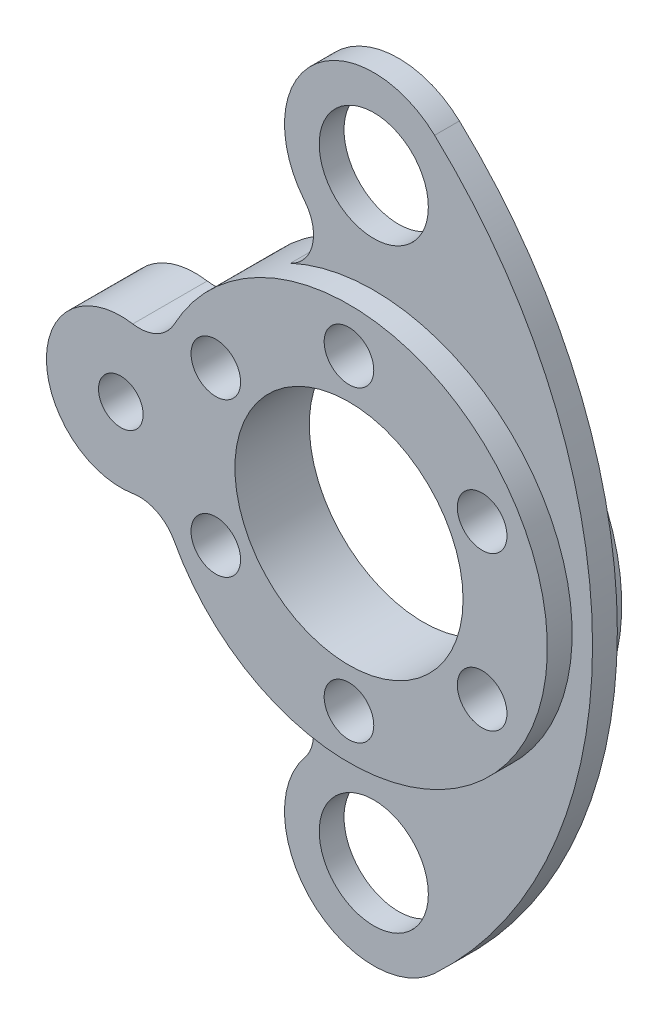
from build123d import *

# Parameters (mm, degrees)
BOSS_EXTRUDE2_DEPTH = 15
SKETCH2_R           = 18
SKETCH2_R_2         = 11
BOSS_EXTRUDE3_DEPTH = 2.5


with BuildPart() as part:
    # Sketch1 → Boss-Extrude2 (new body)
    with BuildSketch(Plane.XY):
        with BuildLine():
            ThreePointArc((28.989440912, 10.982363845), (30.493217838, 5.582442643), (31, 0))
            Line((31, 0), (40, 0))
            ThreePointArc((40, 0), (9.75236872, 38.792928535), (-35.244565217, 18.91614714))
            ThreePointArc((-35.244565217, 18.91614714), (-38.754967124, 15.524494065), (-43.582703214, 14.80394124))
            ThreePointArc((-43.582703214, 14.80394124), (-55.714436376, 11.429336197), (-61, 0))
            Line((-61, 0), (-50.5, 0))
            ThreePointArc((-50.5, 0), (-46, 4.5), (-41.5, 0))
            Line((-41.5, 0), (-31, 0))
            ThreePointArc((-31, 0), (-30.493217838, 5.582442643), (-28.989440912, 10.982363845))
            ThreePointArc((-28.989440912, 10.982363845), (-31.176914536, 18), (-24.005726539, 19.614410349))
            ThreePointArc((-24.005726539, 19.614410349), (-15.5, 26.846787517), (-4.983714373, 30.596774194))
            ThreePointArc((-4.983714373, 30.596774194), (-0.201777274, 35.995926934), (5, 31))
            ThreePointArc((5, 31), (4.995926934, 30.798222726), (4.983714373, 30.596774194))
            ThreePointArc((4.983714373, 30.596774194), (15.5, 26.846787517), (24.005726539, 19.614410349))
            ThreePointArc((24.005726539, 19.614410349), (29.17000674, 19.927488277), (31.846787517, 15.5))
            ThreePointArc((31.846787517, 15.5), (31.072498521, 12.827292288), (28.989440912, 10.982363845))
        make_face()
        with BuildLine():
            Line((40, 0), (31, 0))
            ThreePointArc((31, 0), (30.493217838, -5.582442643), (28.989440912, -10.982363845))
            ThreePointArc((28.989440912, -10.982363845), (31.072498521, -12.827292288), (31.846787517, -15.5))
            ThreePointArc((31.846787517, -15.5), (29.17000674, -19.927488277), (24.005726539, -19.614410349))
            ThreePointArc((24.005726539, -19.614410349), (15.5, -26.846787517), (4.983714373, -30.596774194))
            ThreePointArc((4.983714373, -30.596774194), (4.995926934, -30.798222726), (5, -31))
            ThreePointArc((5, -31), (-0.201777274, -35.995926934), (-4.983714373, -30.596774194))
            ThreePointArc((-4.983714373, -30.596774194), (-15.5, -26.846787517), (-24.005726539, -19.614410349))
            ThreePointArc((-24.005726539, -19.614410349), (-31.176914536, -18), (-28.989440912, -10.982363845))
            ThreePointArc((-28.989440912, -10.982363845), (-30.493217838, -5.582442643), (-31, 0))
            Line((-31, 0), (-41.5, 0))
            ThreePointArc((-41.5, 0), (-46, -4.5), (-50.5, 0))
            Line((-50.5, 0), (-61, 0))
            ThreePointArc((-61, 0), (-55.714436376, -11.429336197), (-43.582703214, -14.80394124))
            ThreePointArc((-43.582703214, -14.80394124), (-38.754967124, -15.524494065), (-35.244565217, -18.91614714))
            ThreePointArc((-35.244565217, -18.91614714), (9.75236872, -38.792928535), (40, 0))
        make_face()
        with BuildLine():
            ThreePointArc((-23, 0), (0, 23), (23, 0))
            Line((23, 0), (31, 0))
            ThreePointArc((31, 0), (30.493217838, 5.582442643), (28.989440912, 10.982363845))
            ThreePointArc((28.989440912, 10.982363845), (22.516660498, 13), (24.005726539, 19.614410349))
            ThreePointArc((24.005726539, 19.614410349), (15.5, 26.846787517), (4.983714373, 30.596774194))
            ThreePointArc((4.983714373, 30.596774194), (0, 26), (-4.983714373, 30.596774194))
            ThreePointArc((-4.983714373, 30.596774194), (-15.5, 26.846787517), (-24.005726539, 19.614410349))
            ThreePointArc((-24.005726539, 19.614410349), (-22.41929924, 17.823219222), (-21.846787517, 15.5))
            ThreePointArc((-21.846787517, 15.5), (-24.174079805, 11.274288996), (-28.989440912, 10.982363845))
            ThreePointArc((-28.989440912, 10.982363845), (-30.493217838, 5.582442643), (-31, 0))
            Line((-31, 0), (-23, 0))
        make_face()
        with BuildLine():
            Line((31, 0), (23, 0))
            ThreePointArc((23, 0), (0, -23), (-23, 0))
            Line((-23, 0), (-31, 0))
            ThreePointArc((-31, 0), (-30.493217838, -5.582442643), (-28.989440912, -10.982363845))
            ThreePointArc((-28.989440912, -10.982363845), (-24.174079805, -11.274288996), (-21.846787517, -15.5))
            ThreePointArc((-21.846787517, -15.5), (-22.41929924, -17.823219222), (-24.005726539, -19.614410349))
            ThreePointArc((-24.005726539, -19.614410349), (-15.5, -26.846787517), (-4.983714373, -30.596774194))
            ThreePointArc((-4.983714373, -30.596774194), (0, -26), (4.983714373, -30.596774194))
            ThreePointArc((4.983714373, -30.596774194), (15.5, -26.846787517), (24.005726539, -19.614410349))
            ThreePointArc((24.005726539, -19.614410349), (22.516660498, -13), (28.989440912, -10.982363845))
            ThreePointArc((28.989440912, -10.982363845), (30.493217838, -5.582442643), (31, 0))
        make_face()
    extrude(amount=-BOSS_EXTRUDE2_DEPTH)

    # Sketch2 → Boss-Extrude3 (add, symmetric)
    # profile 1 of 3: a face of its own
    with BuildSketch(Plane.XY.offset(-7.5)):
        with BuildLine():
            ThreePointArc((12.269141221, 73.170731707), (16.505219507, 67.181763642), (18, 60))
            ThreePointArc((18, 60), (6.03836873, 43.043051481), (-13.94867812, 48.623076923))
            ThreePointArc((-13.94867812, 48.623076923), (-12.352807509, 41.768456097), (-16.790075515, 36.305555556))
            ThreePointArc((-16.790075515, 36.305555556), (21.545266062, 33.701654415), (40, 0))
            ThreePointArc((40, 0), (21.545266062, -33.701654415), (-16.790075515, -36.305555556))
            ThreePointArc((-16.790075515, -36.305555556), (-12.352807509, -41.768456097), (-13.94867812, -48.623076923))
            ThreePointArc((-13.94867812, -48.623076923), (6.03836873, -43.043051481), (18, -60))
            ThreePointArc((18, -60), (16.505219507, -67.181763642), (12.269141221, -73.170731707))
            ThreePointArc((12.269141221, -73.170731707), (44.10724555, 0), (12.269141221, 73.170731707))
        make_face()
    # profile 2 of 3: a face of its own
    with BuildSketch(Plane.XY.offset(-7.5)):
        with Locations((0, 60)):
            Circle(SKETCH2_R)
        with Locations((0, 60)):
            Circle(SKETCH2_R_2, mode=Mode.SUBTRACT)
    # profile 3 of 3: a face of its own
    with BuildSketch(Plane.XY.offset(-7.5)):
        with Locations((0, -60)):
            Circle(SKETCH2_R)
        with Locations((0, -60)):
            Circle(SKETCH2_R_2, mode=Mode.SUBTRACT)
    extrude(amount=BOSS_EXTRUDE3_DEPTH, both=True)


solid = part.part
